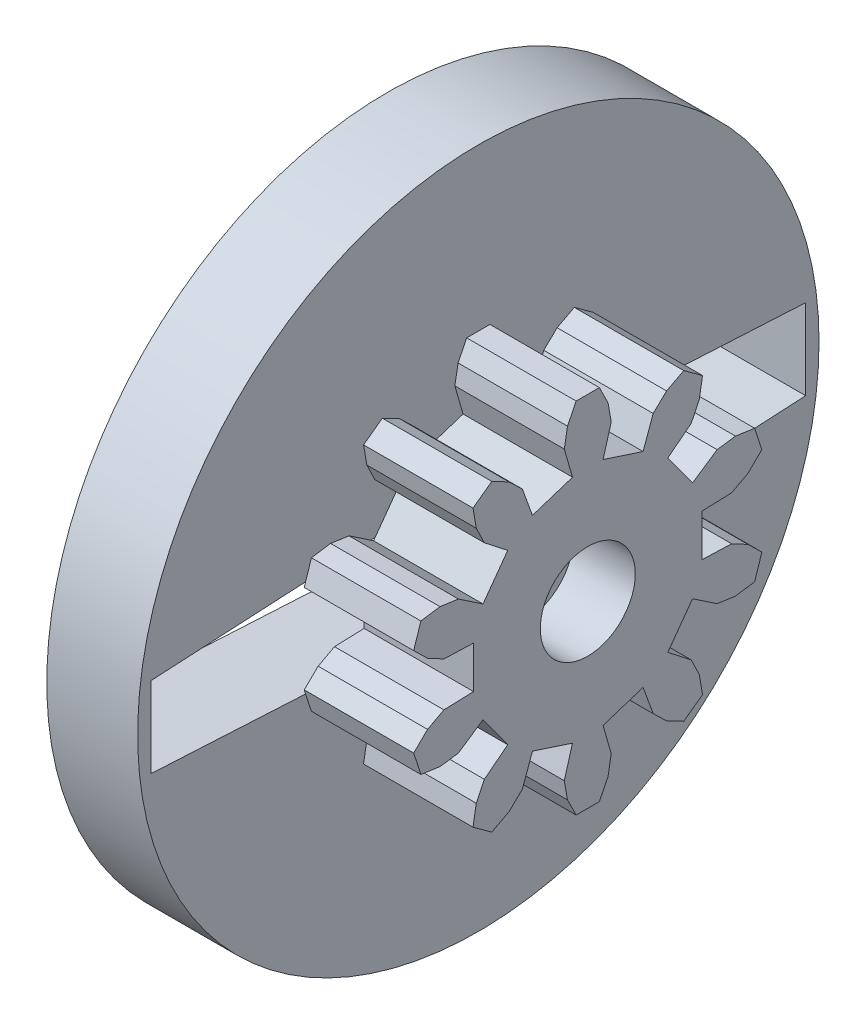
from build123d import *

# Parameters (mm, degrees)
SKETCH1_R           = 16.5
BOSS_EXTRUDE1_DEPTH = 4.4
BOSS_EXTRUDE2_DEPTH = 5.3
SKETCH3_R           = 3.6
CUT_EXTRUDE1_DEPTH  = 4.4
CUT_EXTRUDE2_DEPTH  = 4.4
SKETCH5_R           = 1.2
CUT_EXTRUDE3_DEPTH  = 319.076390196
SKETCH6_R           = 2.3
CUT_EXTRUDE4_DEPTH  = 3


with BuildPart() as part:
    # Sketch1 → Boss-Extrude1 (new body)
    with BuildSketch(Plane(origin=(204.9, 0, 0), x_dir=(0, 0, -1), z_dir=(1, 0, 0))):
        with Locations((-301, 0)):
            Circle(SKETCH1_R)
    extrude(amount=BOSS_EXTRUDE1_DEPTH)

    # Sketch2 → Boss-Extrude2 (add)
    with BuildSketch(Plane(origin=(209.3, 0, 0), x_dir=(0, 0, -1), z_dir=(1, 0, 0))):
        Polygon((-306.532, 1.019), (-307.966, 1.068), (-308.758, 1.491), (-309.431, 2.148), (-309.083, 3.218), (-308.153, 3.354), (-307.264, 3.23), (-306.074, 2.427), (-304.876, 4.076), (-306.008, 4.959), (-306.4, 5.766), (-306.558, 6.693), (-305.648, 7.354), (-304.815, 6.918), (-304.169, 6.295), (-303.679, 4.946), (-301.74, 5.576), (-302.137, 6.955), (-301.98, 7.839), (-301.563, 8.682), (-300.437, 8.682), (-300.02, 7.839), (-299.863, 6.955), (-300.26, 5.576), (-298.321, 4.946), (-297.831, 6.295), (-297.185, 6.918), (-296.352, 7.354), (-295.442, 6.693), (-295.6, 5.766), (-295.992, 4.959), (-297.124, 4.076), (-295.926, 2.427), (-294.736, 3.23), (-293.847, 3.354), (-292.917, 3.218), (-292.569, 2.148), (-293.242, 1.491), (-294.034, 1.068), (-295.468, 1.019), (-295.468, -1.019), (-294.034, -1.068), (-293.242, -1.491), (-292.569, -2.148), (-292.917, -3.218), (-293.847, -3.354), (-294.736, -3.23), (-295.926, -2.427), (-297.124, -4.076), (-295.992, -4.959), (-295.6, -5.766), (-295.442, -6.693), (-296.352, -7.354), (-297.185, -6.918), (-297.831, -6.295), (-298.321, -4.946), (-300.26, -5.576), (-299.863, -6.955), (-300.02, -7.839), (-300.437, -8.682), (-301.563, -8.682), (-301.98, -7.839), (-302.137, -6.955), (-301.74, -5.576), (-303.679, -4.946), (-304.169, -6.295), (-304.815, -6.918), (-305.648, -7.354), (-306.558, -6.693), (-306.4, -5.766), (-306.008, -4.959), (-304.876, -4.076), (-306.074, -2.427), (-307.264, -3.23), (-308.153, -3.354), (-309.083, -3.218), (-309.431, -2.148), (-308.758, -1.491), (-307.966, -1.068), (-306.532, -1.019), align=None)
    extrude(amount=BOSS_EXTRUDE2_DEPTH)

    # Sketch3 → Cut-Extrude1 (cut)
    with BuildSketch(Plane(origin=(204.9, 0, 0), x_dir=(0, 0, -1), z_dir=(1, 0, 0))):
        with Locations((-301, 0)):
            Circle(SKETCH3_R)
    extrude(amount=CUT_EXTRUDE1_DEPTH, mode=Mode.SUBTRACT)

    # Sketch4 → Cut-Extrude2 (cut)
    with BuildSketch(Plane(origin=(204.9, 0, 0), x_dir=(0, 0, -1), z_dir=(1, 0, 0))):
        Polygon((-285.15, -1.95), (-301, -2.8), (-316.85, -1.95), (-316.85, 1.95), (-301, 2.8), (-285.15, 1.95), align=None)
    extrude(amount=CUT_EXTRUDE2_DEPTH, mode=Mode.SUBTRACT)

    # Sketch5 → Cut-Extrude3 (cut, through all)
    with BuildSketch(Plane(origin=(204.9, 0, 0), x_dir=(0, 0, -1), z_dir=(1, 0, 0))):
        with Locations((-301, 0)):
            Circle(SKETCH5_R)
    extrude(amount=CUT_EXTRUDE3_DEPTH, mode=Mode.SUBTRACT)

    # Sketch6 → Cut-Extrude4 (cut)
    with BuildSketch(Plane(origin=(214.6, 0, 0), x_dir=(0, 0, -1), z_dir=(1, 0, 0))):
        with Locations((-301, 0)):
            Circle(SKETCH6_R)
    extrude(amount=-CUT_EXTRUDE4_DEPTH, mode=Mode.SUBTRACT)


solid = part.part
